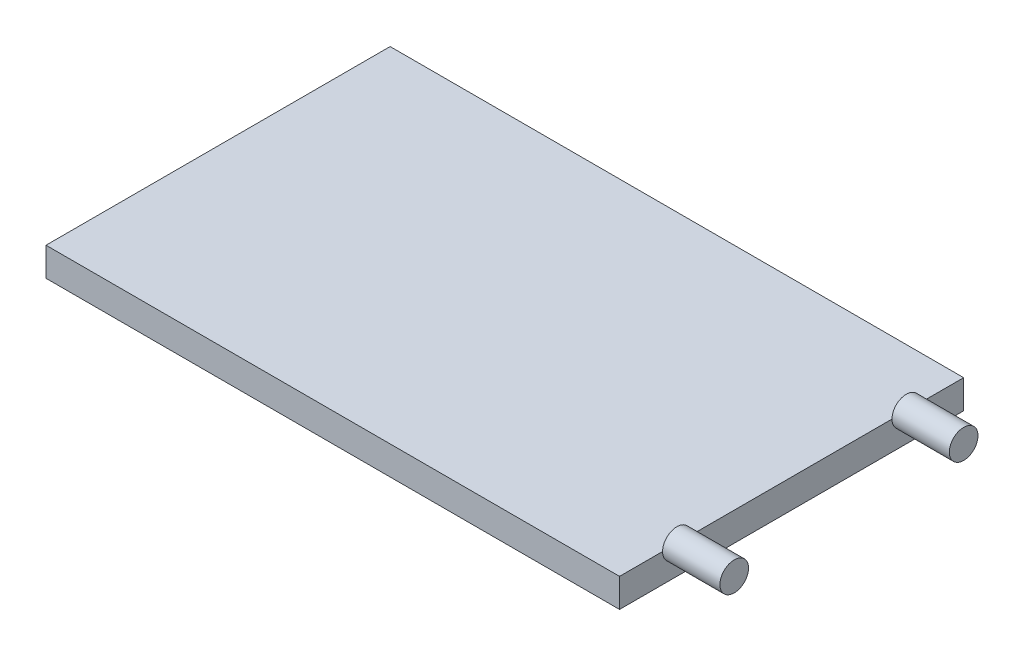
from build123d import *

# Parameters (mm, degrees)
SKETCH_1_W      = 10
SKETCH_1_H      = 6
EXTRUDE_1_DEPTH = 0.5
SKETCH_2_R      = 0.25
EXTRUDE_2_DEPTH = 1


with BuildPart() as part:
    # 스케치1 → 보스-돌출1 (new body)
    with BuildSketch(Plane(origin=(0, 0, 0), x_dir=(1, 0, 0), z_dir=(0, 1, 0))):
        Rectangle(SKETCH_1_W, SKETCH_1_H)
    extrude(amount=EXTRUDE_1_DEPTH)

    # 스케치2 → 보스-돌출2 (add)
    with BuildSketch(Plane(origin=(5, 0, 0), x_dir=(0, 0, -1), z_dir=(1, 0, 0))):
        with Locations((-2, 0.5)):
            Circle(SKETCH_2_R)
        with Locations((2, 0.5)):
            Circle(SKETCH_2_R)
    extrude(amount=EXTRUDE_2_DEPTH)


solid = part.part
